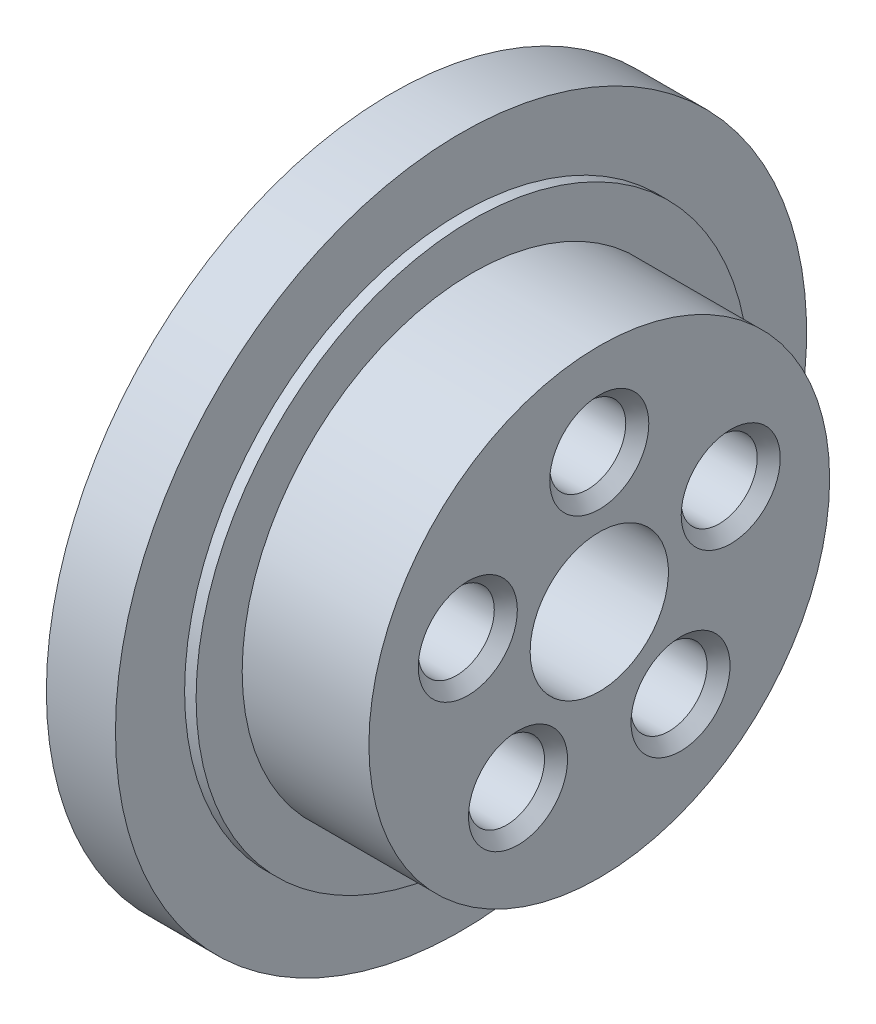
from build123d import *

# Parameters (mm, degrees)
SKETCH2_R          = 2.5
CUT_EXTRUDE1_DEPTH = 4
SKETCH3_R          = 3.3
CUT_EXTRUDE2_DEPTH = 10.5
CHAMFER1_SIZE      = 1


with BuildPart() as part:
    # Sketch1 → Revolve1 (revolve)
    with BuildSketch(Plane.XY, mode=Mode.PRIVATE) as revolve1_sk:
        Polygon((0, 30), (6, 30), (6, 24), (7, 24), (7, 20), (18, 20), (18, 6), (6, 6), (6, 7.5), (0, 7.5), align=None)
    revolve(revolve1_sk.sketch.rotate(Axis((0, 0, 0), (1, 0, 0)), 90), axis=Axis((0, 0, 0), (1, 0, 0)))

    # Sketch2 → Cut-Extrude1 (cut)
    with BuildSketch(Plane.ZY):
        with Locations((0, 20)):
            Circle(SKETCH2_R)
        with Locations((17.320508076, 10)):
            Circle(SKETCH2_R)
        with Locations((17.320508076, -10)):
            Circle(SKETCH2_R)
        with Locations((0, -20)):
            Circle(SKETCH2_R)
        with Locations((-17.320508076, -10)):
            Circle(SKETCH2_R)
        with Locations((-17.320508076, 10)):
            Circle(SKETCH2_R)
    extrude(amount=-CUT_EXTRUDE1_DEPTH, mode=Mode.SUBTRACT)

    # Sketch3 → Cut-Extrude2 (cut)
    with BuildSketch(Plane(origin=(18, 0, 0), x_dir=(0, 0, -1), z_dir=(1, 0, 0))):
        with Locations((0, 12)):
            Circle(SKETCH3_R)
        with Locations((11.412678196, 3.708203932)):
            Circle(SKETCH3_R)
        with Locations((7.053423028, -9.708203932)):
            Circle(SKETCH3_R)
        with Locations((-7.053423028, -9.708203932)):
            Circle(SKETCH3_R)
        with Locations((-11.412678196, 3.708203932)):
            Circle(SKETCH3_R)
    extrude(amount=-CUT_EXTRUDE2_DEPTH, mode=Mode.SUBTRACT)

    # Chamfer1
    chamfer1_edges = [part.edges().sort_by_distance(p)[0] for p in [
        (18, 12, 3.3),
        (18, 3.708203932, -8.112678196),
        (18, -9.708203932, -3.753423028),
        (18, -9.708203932, 10.353423028),
        (18, 3.708203932, 14.712678196),
    ]]
    chamfer(chamfer1_edges, length=CHAMFER1_SIZE)


solid = part.part
